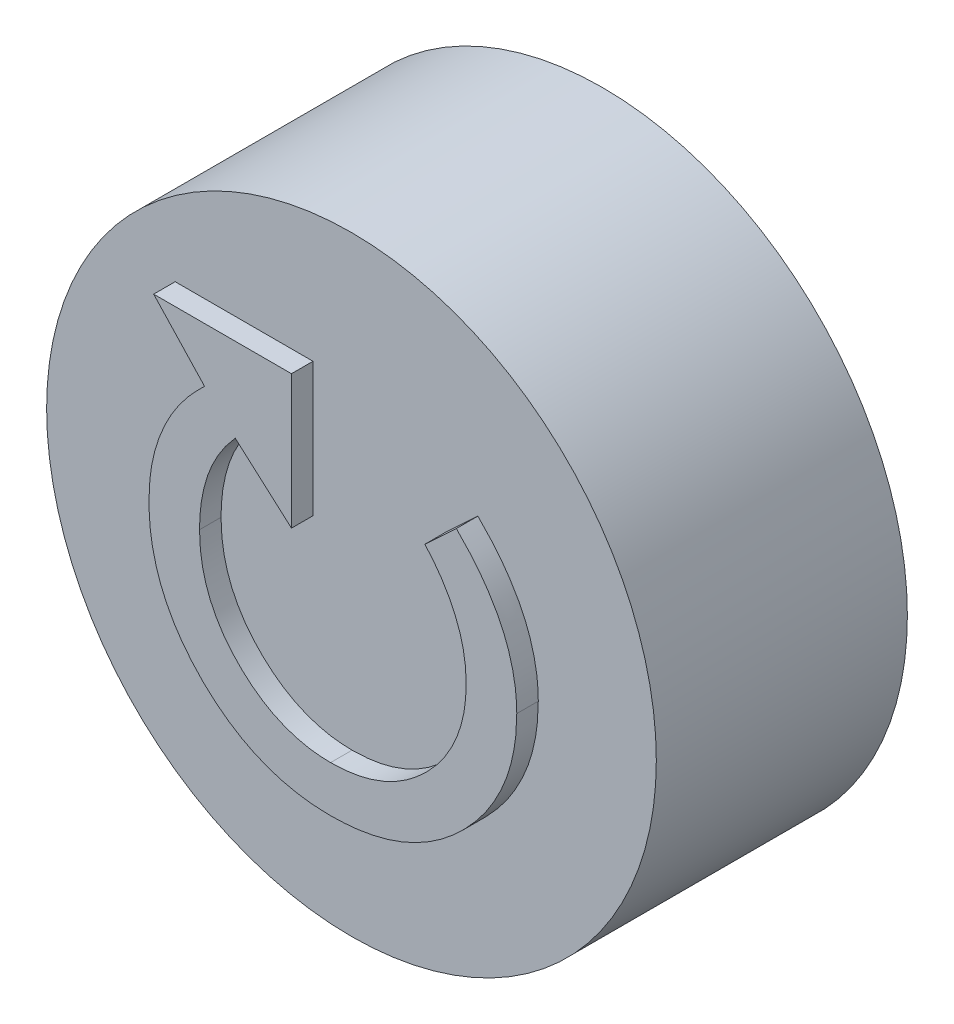
from build123d import *

# Parameters (mm, degrees)
SKETCH1_R           = 8.5
BOSS_EXTRUDE1_DEPTH = 7
BOSS_EXTRUDE2_DEPTH = 0.6
SKETCH3_R           = 5.8
CUT_EXTRUDE1_DEPTH  = 4.15


with BuildPart() as part:
    # Sketch1 → Boss-Extrude1 (new body)
    with BuildSketch(Plane.XY):
        Circle(SKETCH1_R)
    extrude(amount=BOSS_EXTRUDE1_DEPTH)

    # Sketch2 → Boss-Extrude2 (add)
    with BuildSketch(Plane.XY.offset(7)):
        with BuildLine():
            Line((-3.496777173, 3.33685478), (-4.915046404, 4.853281062))
            Line((-4.915046404, 4.853281062), (-1.072898968, 4.853281062))
            Line((-1.072898968, 4.853281062), (-1.072898968, 1.123313114))
            Line((-1.072898968, 1.123313114), (-2.641408583, 2.511534267))
            add(Edge.make_bspline(
                [(-2.641408583, 2.511534267), (-2.720753384, 2.418855801), (-2.878322384, 2.234807782), (-3.080326614, 1.933878452), (-3.253390687, 1.61912069), (-3.395661366, 1.287378065), (-3.502208895, 0.938351436), (-3.581164136, 0.573998239), (-3.627606924, 0.193691534), (-3.633833749, -0.065128908), (-3.637001532, -0.196799066)],
                knots=[0, 0, 0, 0, 0.990413106, 1.966838421, 2.937869788, 3.905121185, 4.893378033, 5.897730606, 6.93050896, 8, 8, 8, 8], degree=3))
            add(Edge.make_bspline(
                [(-3.637001532, -0.196799066), (-3.633314081, -0.328490722), (-3.626080362, -0.586831876), (-3.575666424, -0.966879106), (-3.48901189, -1.329477593), (-3.370773292, -1.677822622), (-3.215507272, -2.009168524), (-3.026563561, -2.324364608), (-2.80395201, -2.623800683), (-2.549784804, -2.902253094), (-2.273703911, -3.157129382), (-1.982206578, -3.380716481), (-1.679065211, -3.570884015), (-1.361911881, -3.723224656), (-1.034237343, -3.844640529), (-0.694609323, -3.930992109), (-0.342601775, -3.981888324), (-0.104181125, -3.989174312), (0.016844622, -3.992872784)],
                knots=[0, 0, 0, 0, 1.079250243, 2.117178572, 3.135310327, 4.130457806, 5.126943688, 6.12839153, 7.13757049, 8.179760785, 9.213873081, 10.213240201, 11.186661469, 12.141254978, 13.091823965, 14.04618213, 15.008213981, 16, 16, 16, 16], degree=3))
            add(Edge.make_bspline(
                [(0.016844622, -3.992872784), (0.145225127, -3.989328055), (0.399045702, -3.982319786), (0.771483518, -3.92919274), (1.130051724, -3.842959504), (1.473171339, -3.720575099), (1.801926634, -3.562161434), (2.117866526, -3.372942158), (2.41516878, -3.142633465), (2.697195125, -2.885792453), (2.953892432, -2.602154952), (3.182127427, -2.302868546), (3.370336038, -1.984922834), (3.528939332, -1.656080542), (3.648009639, -1.310669225), (3.73821301, -0.953238154), (3.787712727, -0.57946122), (3.795125716, -0.325806083), (3.798895904, -0.196799066)],
                knots=[0, 0, 0, 0, 1.033612209, 2.043550498, 3.023051526, 3.999358907, 4.971079349, 5.957874823, 6.959200849, 7.994476354, 9.02612831, 10.03602365, 11.020045963, 11.99661988, 12.971133653, 13.957137591, 14.961016167, 16, 16, 16, 16], degree=3))
            add(Edge.make_bspline(
                [(3.798895904, -0.196799066), (3.795452622, -0.071738589), (3.788588973, 0.177550022), (3.732512198, 0.547316376), (3.642339714, 0.909630301), (3.515407262, 1.263936549), (3.351110497, 1.609595982), (3.154582121, 1.949790991), (2.919499892, 2.281514078), (2.739012005, 2.489632171), (2.647052955, 2.595668883)],
                knots=[0, 0, 0, 0, 0.970334418, 1.934210747, 2.895854909, 3.864734812, 4.850109812, 5.862644845, 6.911011974, 8, 8, 8, 8], degree=3))
            Line((2.647052955, 2.595668883), (3.524456802, 3.412976575))
            add(Edge.make_bspline(
                [(3.524456802, 3.412976575), (3.658278985, 3.275504412), (3.91937115, 3.007290997), (4.264397959, 2.578686277), (4.553163347, 2.138040406), (4.795240196, 1.68988536), (4.980930526, 1.228890741), (5.110227561, 0.756857332), (5.195045563, 0.27566711), (5.204437058, -0.049543732), (5.209152314, -0.212824707)],
                knots=[0, 0, 0, 0, 1.119978514, 2.185120635, 3.207184244, 4.192840501, 5.155195957, 6.102228941, 7.047172264, 8, 8, 8, 8], degree=3))
            add(Edge.make_bspline(
                [(5.209152314, -0.212824707), (5.204540212, -0.382014013), (5.195439592, -0.715859062), (5.12297081, -1.207015128), (5.007595574, -1.680619371), (4.842005, -2.136576039), (4.627397829, -2.574094346), (4.371358267, -2.997310094), (4.06311267, -3.39955484), (3.713795898, -3.780248165), (3.331337364, -4.130160805), (2.922899491, -4.437565389), (2.490856262, -4.694704345), (2.038857832, -4.9089885), (1.563247201, -5.073941917), (1.066251184, -5.188891521), (0.548487363, -5.261364491), (0.196039665, -5.270353687), (0.016844622, -5.274924066)],
                knots=[0, 0, 0, 0, 1.006511856, 1.986053414, 2.947928005, 3.903304009, 4.866581259, 5.843887477, 6.842136409, 7.877167342, 8.915131082, 9.922897295, 10.913810849, 11.902179308, 12.895003365, 13.90323956, 14.933943735, 16, 16, 16, 16], degree=3))
            add(Edge.make_bspline(
                [(0.016844622, -5.274924066), (-0.154981037, -5.270101549), (-0.493322306, -5.26060555), (-0.991507142, -5.1914642), (-1.470001358, -5.07522348), (-1.929693111, -4.911786456), (-2.370270316, -4.702826529), (-2.791145936, -4.446149677), (-3.192948817, -4.14431338), (-3.57070976, -3.800322782), (-3.913756475, -3.422137917), (-4.219341638, -3.023295532), (-4.474952699, -2.601787942), (-4.684175633, -2.161406889), (-4.847542361, -1.701662708), (-4.963802172, -1.22318273), (-5.032938356, -0.724994042), (-5.042435065, -0.386653302), (-5.047257942, -0.214827912)],
                knots=[0, 0, 0, 0, 1.035645246, 2.039285224, 3.025359342, 3.999339005, 4.975246586, 5.959692554, 6.966033149, 8.00039464, 9.034756131, 10.040307446, 11.024753414, 12.000660995, 12.974640658, 13.960714776, 14.964354754, 16, 16, 16, 16], degree=3))
            add(Edge.make_bspline(
                [(-5.047257942, -0.214827912), (-5.042718501, -0.042971038), (-5.033757492, 0.296280149), (-4.960307444, 0.794688321), (-4.838251028, 1.272224933), (-4.665501402, 1.727921947), (-4.449759875, 2.165386428), (-4.180027486, 2.580020601), (-3.863065273, 2.974774534), (-3.620105292, 3.214943433), (-3.496777173, 3.33685478)],
                knots=[0, 0, 0, 0, 1.032765718, 2.038713884, 3.021079012, 3.990324489, 4.963319928, 5.947610502, 6.958193293, 8, 8, 8, 8], degree=3))
        make_face()
    extrude(amount=BOSS_EXTRUDE2_DEPTH)

    # Sketch3 → Cut-Extrude1 (cut)
    with BuildSketch(Plane(origin=(0, 0, 0), x_dir=(-1, 0, 0), z_dir=(0, 0, -1))):
        Circle(SKETCH3_R)
    extrude(amount=-CUT_EXTRUDE1_DEPTH, mode=Mode.SUBTRACT)


solid = part.part
